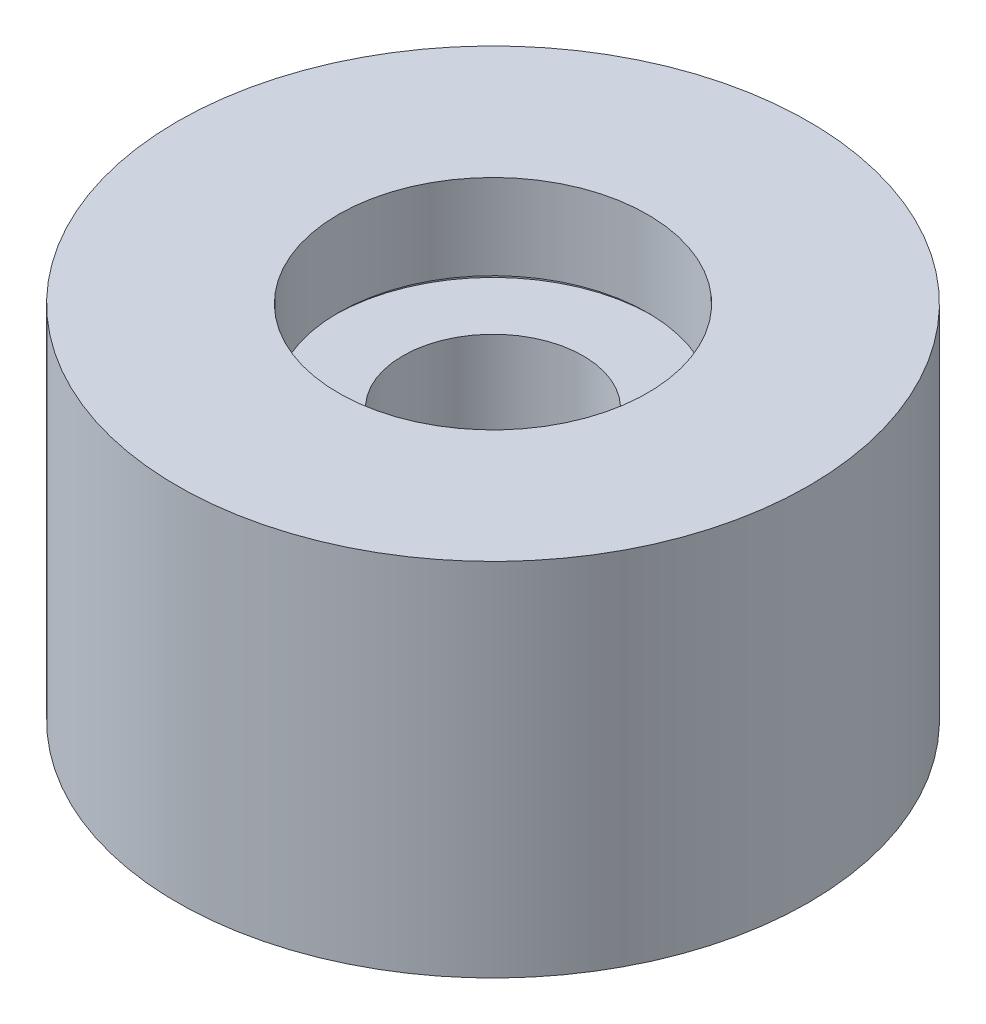
from build123d import *


with BuildPart() as part:
    # Szkic1 → Obrót1 (revolve)
    with BuildSketch(Plane.XY):
        Polygon((-60, 104.974625624), (-122.5, 104.974625624), (-122.5, -35.025374376), (-60, -35.025374376), (-35, -35.025374376), (-35, 69.974625624), (-60, 69.974625624), (-62, 69.974625624), (-62, 71.974625624), (-60, 71.974625624), align=None)
    revolve(axis=Axis((0, 104.974625624, 0), (0, -1, 0)))


solid = part.part
